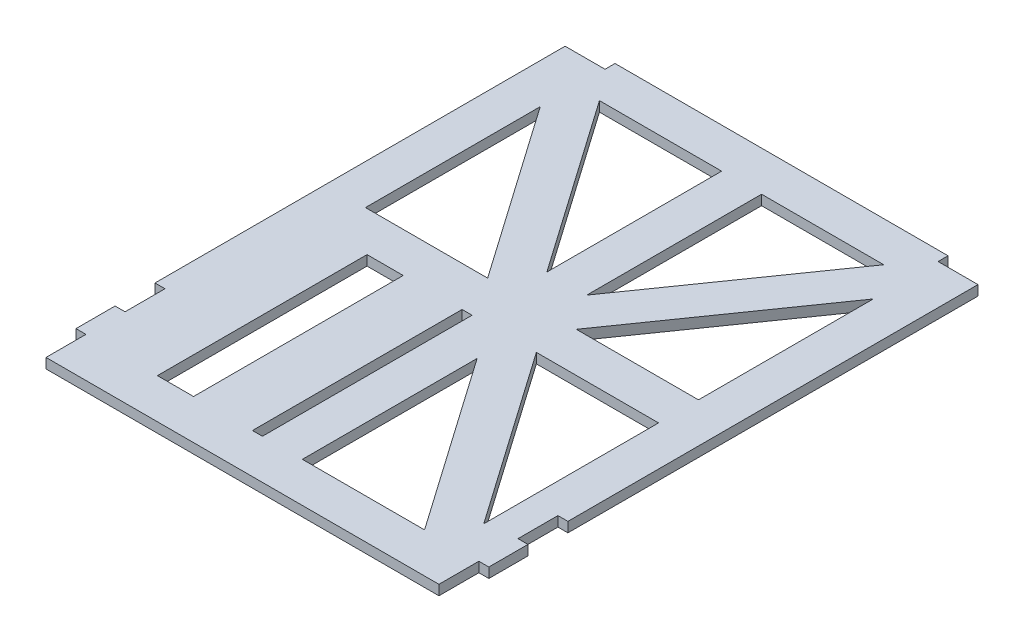
from build123d import *

# Parameters (mm, degrees)
SKETCH1_W           = 11.5
SKETCH1_H           = 66.675
SKETCH1_W_2         = 3.175
BOSS_EXTRUDE1_DEPTH = 3.175


with BuildPart() as part:
    # Sketch1 → Boss-Extrude1 (new body)
    with BuildSketch(Plane(origin=(0, 0, 0), x_dir=(1, 0, 0), z_dir=(0, 1, 0))):
        Polygon((-52.96, 85.881432482), (52.96, 85.881432482), (52.96, 82.706432482), (65.66, 82.706432482), (65.66, -47.723567518), (62.485, -47.723567518), (62.485, -60.423567518), (65.66, -60.423567518), (65.66, -72.868567518), (62.485, -72.868567518), (62.485, -85.568567518), (-62.485, -85.568567518), (-62.485, -72.868567518), (-65.66, -72.868567518), (-65.66, -60.423567518), (-62.485, -60.423567518), (-62.485, -47.723567518), (-65.66, -47.723567518), (-65.66, 82.706432482), (-52.96, 82.706432482), align=None)
        Polygon((-52.96, 6.506432482), (-14.097750884, 6.506432482), (-52.96, 62.098375408), align=None, mode=Mode.SUBTRACT)
        Polygon((-45.212249116, 73.181432482), (-6.35, 73.181432482), (-6.35, 17.589489555), align=None, mode=Mode.SUBTRACT)
        with Locations((-34.0045, -39.531067518)):
            Rectangle(SKETCH1_W, SKETCH1_H, mode=Mode.SUBTRACT)
        Polygon((52.96, 62.098375408), (52.96, 6.506432482), (14.097750884, 6.506432482), align=None, mode=Mode.SUBTRACT)
        Polygon((6.35, 73.181432482), (6.35, 17.589489555), (45.212249116, 73.181432482), align=None, mode=Mode.SUBTRACT)
        Polygon((14.097750884, -6.193567518), (52.96, -6.193567518), (52.96, -61.785510445), align=None, mode=Mode.SUBTRACT)
        Polygon((6.35, -17.276624592), (45.212249116, -72.868567518), (6.35, -72.868567518), align=None, mode=Mode.SUBTRACT)
        with Locations((-7.9375, -39.531067518)):
            Rectangle(SKETCH1_W_2, SKETCH1_H, mode=Mode.SUBTRACT)
    extrude(amount=BOSS_EXTRUDE1_DEPTH)


solid = part.part
